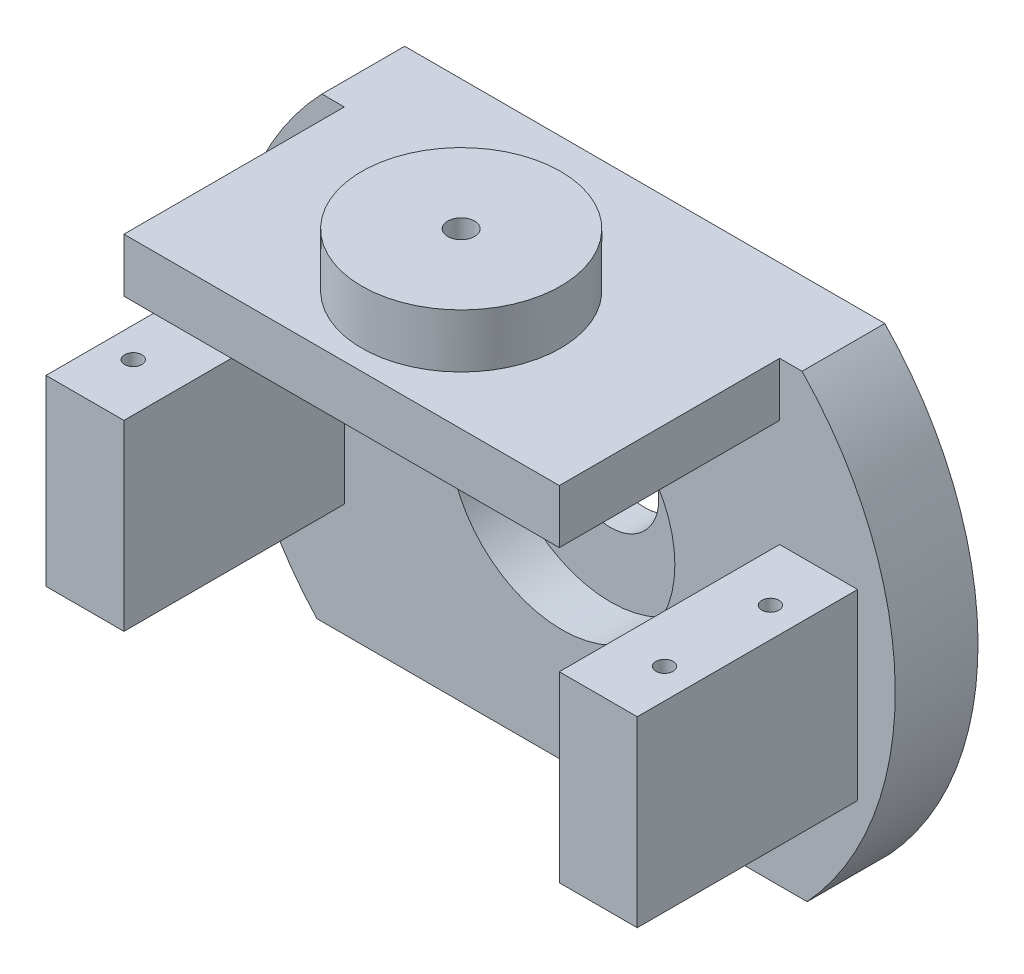
from build123d import *

# Parameters (mm, degrees)
ESQUISSE1_W              = 55
ESQUISSE1_H              = 43
BOSS_EXTRU_1_DEPTH       = 27
ESQUISSE2_W              = 40.5
ESQUISSE2_H              = 21.676575317
ENL_V_MAT_EXTRU_1_DEPTH  = 38
ESQUISSE3_R              = 0.7
ENL_V_MAT_EXTRU_2_DEPTH  = 43
ESQUISSE4_W              = 55
ESQUISSE4_H              = 20.5
ENL_V_MAT_EXTRU_3_DEPTH  = 11
ENL_V_MAT_EXTRU_6_REACH  = 66.933
ESQUISSE5_W              = 20.5
ESQUISSE5_H              = 10
ESQUISSE6_W              = 7.25
ESQUISSE6_H              = 20.5
ENL_V_MAT_EXTRU_7_DEPTH  = 5
ESQUISSE7_R              = 31
BOSS_EXTRU_2_DEPTH       = 6.5
ESQUISSE8_R              = 41
ESQUISSE8_R_2            = 31
ENL_V_MAT_EXTRU_8_DEPTH  = 6.5
TROU_TARAUD_M2X0_41_D    = 1.6
ESQUISSE10_R             = 10.5
ENL_V_MAT_EXTRU_9_DEPTH  = 4.5
ESQUISSE11_R             = 4.5
ENL_V_MAT_EXTRU_10_DEPTH = 2
ESQUISSE12_R             = 9.25
ESQUISSE12_R_2           = 1.25
BOSS_EXTRU_3_DEPTH       = 5
ESQUISSE13_W             = 50.114904395
ESQUISSE13_H             = 12.012600019
ENL_V_MAT_EXTRU_11_DEPTH = 6.5
BOSS_EXTRU_4_START       = 1.2
BOSS_EXTRU_4_DEPTH       = 1.2
ESQUISSE15_W             = 53.005482756
ESQUISSE15_H             = 10
ENL_V_MAT_EXTRU_12_DEPTH = 7.7
ESQUISSE16_R             = 4.5
ENL_V_MAT_EXTRU_13_DEPTH = 1.2


with BuildPart() as part:
    # Esquisse1 → Boss.-Extru.1 (new body)
    with BuildSketch(Plane.XY):
        Rectangle(ESQUISSE1_W, ESQUISSE1_H)
    extrude(amount=BOSS_EXTRU_1_DEPTH)

    # Esquisse2 → Enlèv. mat.-Extru.1 (cut)
    with BuildSketch(Plane.XZ.offset(21.5)):
        with Locations((0, 17.338287659)):
            Rectangle(ESQUISSE2_W, ESQUISSE2_H)
    extrude(amount=-ENL_V_MAT_EXTRU_1_DEPTH, mode=Mode.SUBTRACT)

    # Esquisse3 → Enlèv. mat.-Extru.2 (cut)
    with BuildSketch(Plane.XZ.offset(21.5)):
        with Locations(Location((-24.71, 21.675, 0), (0, 0, 270))):
            Circle(ESQUISSE3_R)
        with Locations(Location((-24.71, 11.825, 0), (0, 0, 270))):
            Circle(ESQUISSE3_R)
        with Locations(Location((24.71, 11.825, 0), (0, 0, 270))):
            Circle(ESQUISSE3_R)
        with Locations(Location((24.71, 21.675, 0), (0, 0, 270))):
            Circle(ESQUISSE3_R)
    extrude(amount=-ENL_V_MAT_EXTRU_2_DEPTH, mode=Mode.SUBTRACT)

    # Esquisse4 → Enlèv. mat.-Extru.3 (cut)
    with BuildSketch(Plane.XZ.offset(21.5)):
        with Locations((0, 16.75)):
            Rectangle(ESQUISSE4_W, ESQUISSE4_H)
    extrude(amount=-ENL_V_MAT_EXTRU_3_DEPTH, mode=Mode.SUBTRACT)

    # Enlèv. mat.-Extru.6: up to this face of the body (flat: up to its plane)
    enl_v_mat_extru_6_end = Plane(part.part.faces().sort_by_distance((27.5, 3.85676109, 12.716595404))[0])
    # Esquisse5 → Enlèv. mat.-Extru.6 (cut, up to the picked face)
    with BuildSketch(Plane.ZY.offset(27.5), mode=Mode.PRIVATE) as enl_v_mat_extru_6_sk1:
        with Locations((16.75, 11.5)):
            Rectangle(ESQUISSE5_W, ESQUISSE5_H)
    enl_v_mat_extru_6_tool1 = split(extrude(enl_v_mat_extru_6_sk1.sketch, amount=-ENL_V_MAT_EXTRU_6_REACH, mode=Mode.PRIVATE), bisect_by=enl_v_mat_extru_6_end, keep=Keep.BOTH, mode=Mode.PRIVATE)
    add(enl_v_mat_extru_6_tool1.solids().sort_by(Axis((-27.5, 11.5, 16.75), (1, 0, 0)))[0], mode=Mode.SUBTRACT)

    # Esquisse6 → Enlèv. mat.-Extru.7 (cut)
    with BuildSketch(Plane.XZ.offset(-16.5)):
        with Locations((-23.875, 16.75)):
            Rectangle(ESQUISSE6_W, ESQUISSE6_H)
        with Locations((23.875, 16.75)):
            Rectangle(ESQUISSE6_W, ESQUISSE6_H)
    extrude(amount=-ENL_V_MAT_EXTRU_7_DEPTH, mode=Mode.SUBTRACT)

    # Esquisse7 → Boss.-Extru.2 (add)
    with BuildSketch(Plane(origin=(0, 0, 0), x_dir=(-1, 0, 0), z_dir=(0, 0, -1))):
        Circle(ESQUISSE7_R)
    extrude(amount=-BOSS_EXTRU_2_DEPTH)

    # Esquisse8 → Enlèv. mat.-Extru.8 (cut)
    with BuildSketch(Plane(origin=(0, 0, 0), x_dir=(-1, 0, 0), z_dir=(0, 0, -1))):
        Circle(ESQUISSE8_R)
        Circle(ESQUISSE8_R_2, mode=Mode.SUBTRACT)
    extrude(amount=-ENL_V_MAT_EXTRU_8_DEPTH, mode=Mode.SUBTRACT)

    # Trou taraudé M2x0.41 (through all)
    with Locations(Plane(origin=(-24.71, -10.5, 21.675), x_dir=(0, 0, -1), z_dir=(0, -1, 0))):
        with Locations((0, 0), (9.85, 0), (0, 49.42), (9.85, 49.42)):
            Hole(TROU_TARAUD_M2X0_41_D / 2)

    # Esquisse10 → Enlèv. mat.-Extru.9 (cut)
    with BuildSketch(Plane.XY.offset(6.5)):
        Circle(ESQUISSE10_R)
    extrude(amount=-ENL_V_MAT_EXTRU_9_DEPTH, mode=Mode.SUBTRACT)

    # Esquisse11 → Enlèv. mat.-Extru.10 (cut)
    with BuildSketch(Plane.XY.offset(2)):
        Circle(ESQUISSE11_R)
    extrude(amount=-ENL_V_MAT_EXTRU_10_DEPTH, mode=Mode.SUBTRACT)

    # Esquisse12 → Boss.-Extru.3 (add)
    with BuildSketch(Plane(origin=(0, 21.5, 0), x_dir=(1, 0, 0), z_dir=(0, 1, 0))):
        with Locations(Location((0, -15.876822983, 0), (0, 0, 90))):
            Circle(ESQUISSE12_R)
        with Locations(Location((0, -15.876822983, 0), (0, 0, 270))):
            Circle(ESQUISSE12_R_2, mode=Mode.SUBTRACT)
    extrude(amount=BOSS_EXTRU_3_DEPTH)

    # Esquisse13 → Enlèv. mat.-Extru.11 (cut)
    with BuildSketch(Plane.XY.offset(6.5)):
        with Locations((-0.983340997, 27.50630001)):
            Rectangle(ESQUISSE13_W, ESQUISSE13_H)
    extrude(amount=-ENL_V_MAT_EXTRU_11_DEPTH, mode=Mode.SUBTRACT)

    # Esquisse14 → Boss.-Extru.4 (add)
    with BuildSketch(Plane(origin=(0, 0, 0), x_dir=(-1, 0, 0), z_dir=(0, 0, -1)).offset(BOSS_EXTRU_4_START)):
        with BuildLine():
            Line((-22.332711434, 21.5), (22.332711434, 21.5))
            ThreePointArc((22.332711434, 21.5), (0, -31), (-22.332711434, 21.5))
        make_face()
    extrude(amount=-BOSS_EXTRU_4_DEPTH)

    # Esquisse15 → Enlèv. mat.-Extru.12 (cut)
    with BuildSketch(Plane.XY.offset(6.5)):
        with Locations((0, -26)):
            Rectangle(ESQUISSE15_W, ESQUISSE15_H)
    extrude(amount=-ENL_V_MAT_EXTRU_12_DEPTH, mode=Mode.SUBTRACT)

    # Esquisse16 → Enlèv. mat.-Extru.13 (cut)
    with BuildSketch(Plane.XY):
        Circle(ESQUISSE16_R)
    extrude(amount=-ENL_V_MAT_EXTRU_13_DEPTH, mode=Mode.SUBTRACT)


solid = part.part
